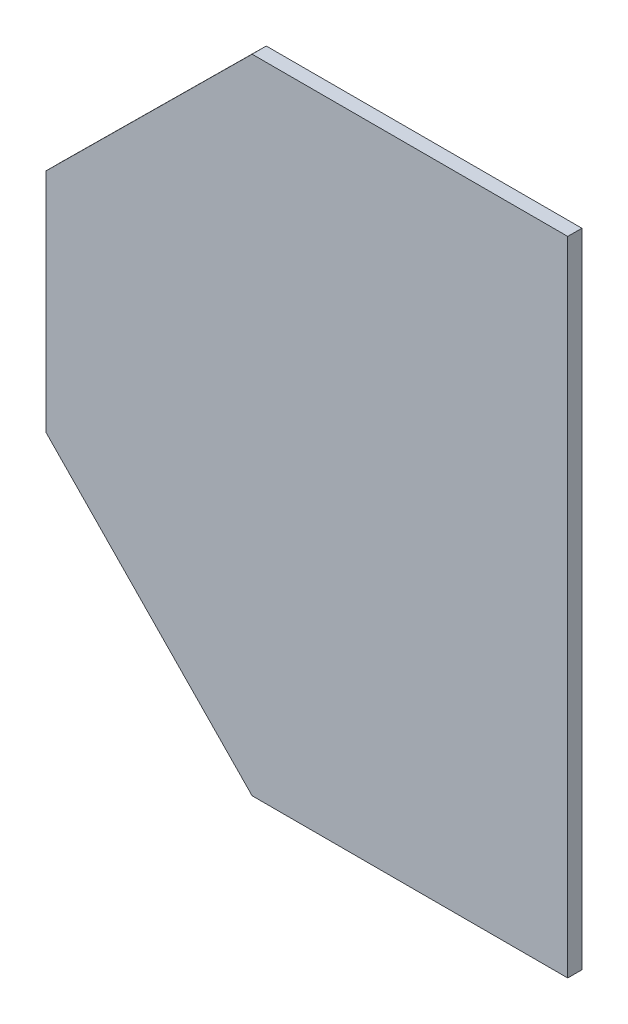
from build123d import *

# Parameters (mm, degrees)
BOSS_EXTRUDE1_DEPTH = 9.525


with BuildPart() as part:
    # Sketch1 → Boss-Extrude1 (new body)
    with BuildSketch(Plane.XY):
        Polygon((-4.280950931, -146.790318846), (-216.488062196, -146.790318846), (-354.995654443, -4.562065129), (-354.995654443, 147.837934871), (-216.488062196, 285.009681154), (-4.280950931, 285.009681154), align=None)
    extrude(amount=BOSS_EXTRUDE1_DEPTH)


solid = part.part
